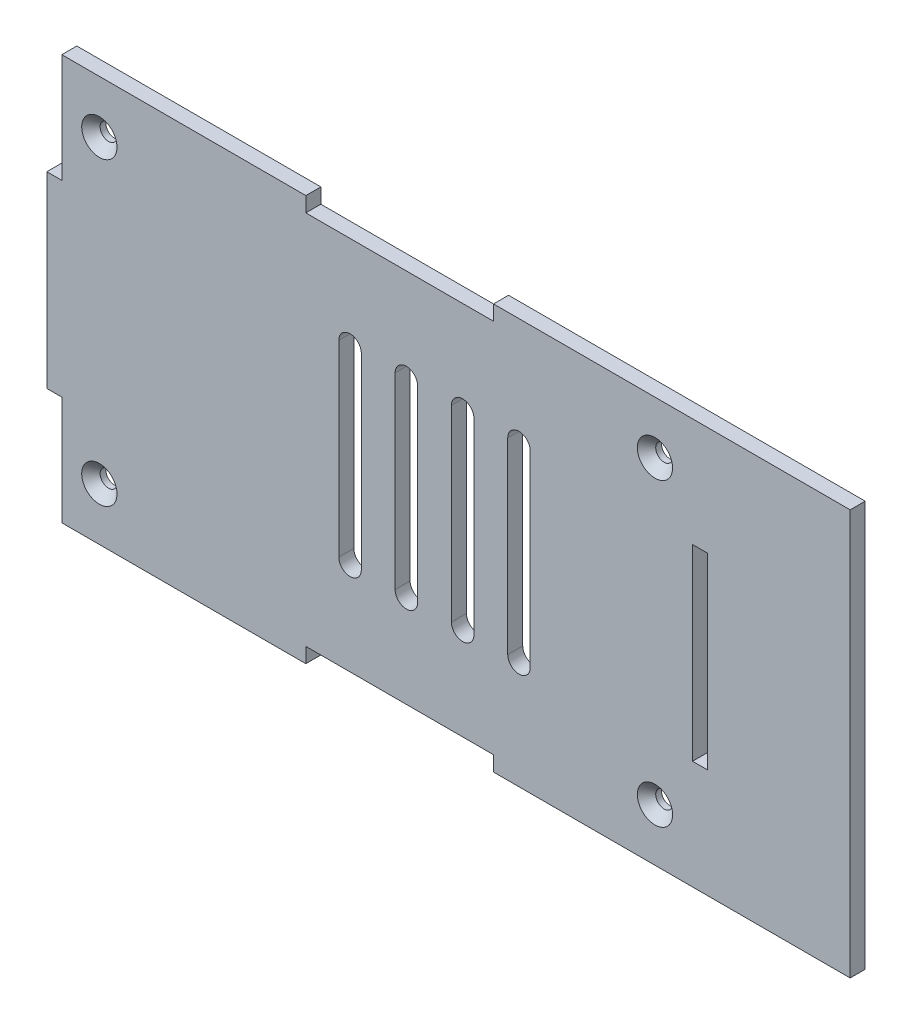
from build123d import *

# Parameters (mm, degrees)
BOSS_EXTRUDE1_DEPTH                          = 4
CUT_EXTRUDE1_REACH                           = 222.744
SKETCH2_W                                    = 4
SKETCH2_H                                    = 50
CSK_FOR_M4_COUNTERSUNK_FLAT_HEAD_SCR_2_COUNT = 2
CSK_FOR_M4_COUNTERSUNK_FLAT_HEAD_SCR_2_PITCH = 148
CSK_FOR_M4_COUNTERSUNK_FLAT_HEAD_SCR_3_COUNT = 2
CSK_FOR_M4_COUNTERSUNK_FLAT_HEAD_SCR_3_PITCH = 168.237926759
CSK_FOR_M4_COUNTERSUNK_FLAT_HEAD_SCR_4_COUNT = 2
CSK_FOR_M4_COUNTERSUNK_FLAT_HEAD_SCR_4_PITCH = 80
CUT_EXTRUDE2_REACH                           = 222.744


with BuildPart() as part:
    # Sketch1 → Boss-Extrude1 (new body)
    with BuildSketch(Plane.XY):
        Polygon((0, 25), (0, 0), (214, 0), (214, 54), (119, 54), (119, 50), (69, 50), (69, 54), (4, 54), (4, 25), align=None)
        Polygon((0, 0), (0, -25), (4, -25), (4, -54), (69, -54), (69, -50), (119, -50), (119, -54), (214, -54), (214, 0), align=None)
    extrude(amount=BOSS_EXTRUDE1_DEPTH)

    # Sketch2 → Cut-Extrude1 (cut, up to next)
    with BuildSketch(Plane.XY.offset(4), mode=Mode.PRIVATE) as cut_extrude1_sk1:
        with Locations((174, 0)):
            Rectangle(SKETCH2_W, SKETCH2_H)
    cut_extrude1_tool1 = extrude(cut_extrude1_sk1.sketch, amount=-CUT_EXTRUDE1_REACH, mode=Mode.PRIVATE) & part.part
    add(cut_extrude1_tool1.solids().sort_by_distance((174, 0, 4))[0], mode=Mode.SUBTRACT)

    # Sketch4 → CSK for M4 Countersunk Flat Head Screw1 (revolve, cut)
    with BuildSketch(Plane(origin=(14, 40, 4), x_dir=(0, -1, 0), z_dir=(1, 0, 0))):
        Polygon((0, 0), (0, 4), (2.25, 4), (2.25, 2.45), (4.7, 0), align=None)
    csk_for_m4_countersunk_flat_head_screw1 = revolve(axis=Axis((14, 40, 10.35), (0, 0, -1)), mode=Mode.SUBTRACT)

    # CSK for M4 Countersunk Flat Head Scr 2: CSK for M4 Countersunk Flat Head Screw1 ×2
    with Locations(*[(i * CSK_FOR_M4_COUNTERSUNK_FLAT_HEAD_SCR_2_PITCH, 0, 0) for i in range(1, CSK_FOR_M4_COUNTERSUNK_FLAT_HEAD_SCR_2_COUNT)]):
        add(csk_for_m4_countersunk_flat_head_screw1, mode=Mode.SUBTRACT)

    # CSK for M4 Countersunk Flat Head Scr 3: CSK for M4 Countersunk Flat Head Screw1 ×2
    with Locations(*[Vector(0.8797065135761271, -0.47551703436547405, 0) * (i * CSK_FOR_M4_COUNTERSUNK_FLAT_HEAD_SCR_3_PITCH) for i in range(1, CSK_FOR_M4_COUNTERSUNK_FLAT_HEAD_SCR_3_COUNT)]):
        add(csk_for_m4_countersunk_flat_head_screw1, mode=Mode.SUBTRACT)

    # CSK for M4 Countersunk Flat Head Scr 4: CSK for M4 Countersunk Flat Head Screw1 ×2
    with Locations(*[(0, -i * CSK_FOR_M4_COUNTERSUNK_FLAT_HEAD_SCR_4_PITCH, 0) for i in range(1, CSK_FOR_M4_COUNTERSUNK_FLAT_HEAD_SCR_4_COUNT)]):
        add(csk_for_m4_countersunk_flat_head_screw1, mode=Mode.SUBTRACT)

    # Sketch5 → Cut-Extrude2 (cut, up to next)
    with BuildSketch(Plane(origin=(0, 0, 0), x_dir=(-1, 0, 0), z_dir=(0, 0, -1)), mode=Mode.PRIVATE) as cut_extrude2_sk1:
        with BuildLine():
            Line((-122.777043469, 25), (-122.777043469, -25))
            ThreePointArc((-122.777043469, -25), (-125.777043469, -28), (-128.777043469, -25))
            Line((-128.777043469, -25), (-128.777043469, 25))
            ThreePointArc((-128.777043469, 25), (-125.777043469, 28), (-122.777043469, 25))
        make_face()
    cut_extrude2_tool1 = extrude(cut_extrude2_sk1.sketch, amount=-CUT_EXTRUDE2_REACH, mode=Mode.PRIVATE) & part.part
    # Sketch5 → Cut-Extrude2 (cut, up to next)
    with BuildSketch(Plane(origin=(0, 0, 0), x_dir=(-1, 0, 0), z_dir=(0, 0, -1)), mode=Mode.PRIVATE) as cut_extrude2_sk2:
        with BuildLine():
            Line((-113.777043469, 25), (-113.777043469, -25))
            ThreePointArc((-113.777043469, -25), (-110.777043469, -28), (-107.777043469, -25))
            Line((-107.777043469, -25), (-107.777043469, 25))
            ThreePointArc((-107.777043469, 25), (-110.777043469, 28), (-113.777043469, 25))
        make_face()
    cut_extrude2_tool2 = extrude(cut_extrude2_sk2.sketch, amount=-CUT_EXTRUDE2_REACH, mode=Mode.PRIVATE) & part.part
    # Sketch5 → Cut-Extrude2 (cut, up to next)
    with BuildSketch(Plane(origin=(0, 0, 0), x_dir=(-1, 0, 0), z_dir=(0, 0, -1)), mode=Mode.PRIVATE) as cut_extrude2_sk3:
        with BuildLine():
            Line((-98.777043469, 25), (-98.777043469, -25))
            ThreePointArc((-98.777043469, -25), (-95.777043469, -28), (-92.777043469, -25))
            Line((-92.777043469, -25), (-92.777043469, 25))
            ThreePointArc((-92.777043469, 25), (-95.777043469, 28), (-98.777043469, 25))
        make_face()
    cut_extrude2_tool3 = extrude(cut_extrude2_sk3.sketch, amount=-CUT_EXTRUDE2_REACH, mode=Mode.PRIVATE) & part.part
    # Sketch5 → Cut-Extrude2 (cut, up to next)
    with BuildSketch(Plane(origin=(0, 0, 0), x_dir=(-1, 0, 0), z_dir=(0, 0, -1)), mode=Mode.PRIVATE) as cut_extrude2_sk4:
        with BuildLine():
            Line((-83.777043469, 25), (-83.777043469, -25))
            ThreePointArc((-83.777043469, -25), (-80.777043469, -28), (-77.777043469, -25))
            Line((-77.777043469, -25), (-77.777043469, 25))
            ThreePointArc((-77.777043469, 25), (-80.777043469, 28), (-83.777043469, 25))
        make_face()
    cut_extrude2_tool4 = extrude(cut_extrude2_sk4.sketch, amount=-CUT_EXTRUDE2_REACH, mode=Mode.PRIVATE) & part.part
    add(cut_extrude2_tool1.solids().sort_by_distance((125.777043, 0, 0))[0], mode=Mode.SUBTRACT)
    add(cut_extrude2_tool2.solids().sort_by_distance((110.777043, 0, 0))[0], mode=Mode.SUBTRACT)
    add(cut_extrude2_tool3.solids().sort_by_distance((95.777043, 0, 0))[0], mode=Mode.SUBTRACT)
    add(cut_extrude2_tool4.solids().sort_by_distance((80.777043, 0, 0))[0], mode=Mode.SUBTRACT)


solid = part.part
